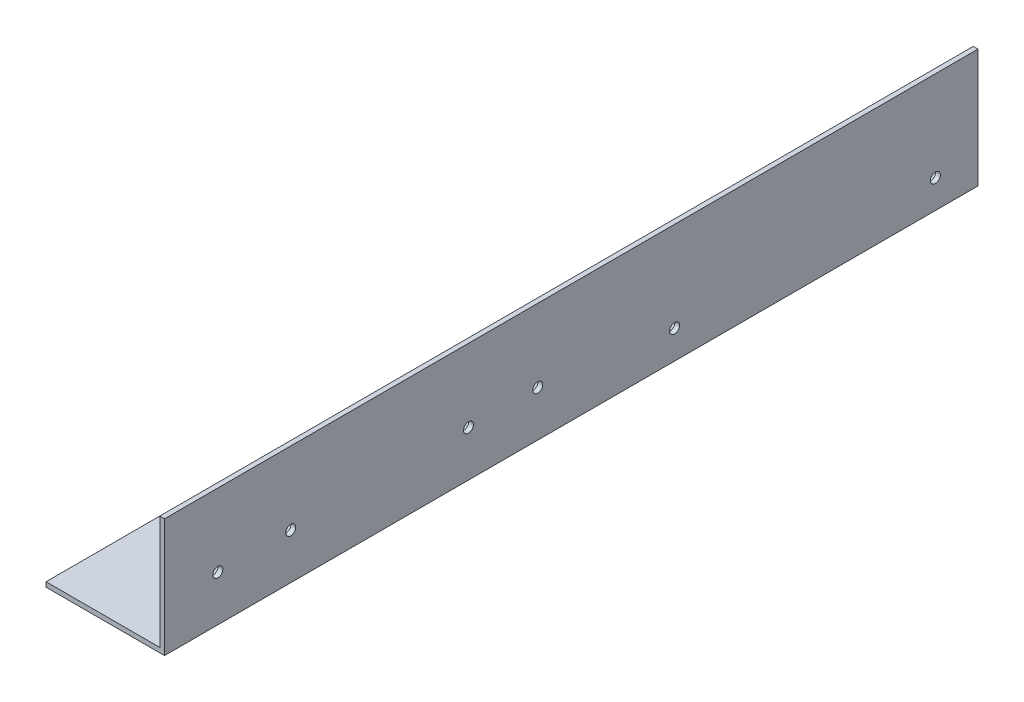
from build123d import *

# Parameters (mm, degrees)
BOSS_EXTRUDE1_DEPTH = 343.25
SKETCH2_R           = 2.1
CUT_EXTRUDE1_DEPTH  = 5
SKETCH3_R           = 2.1
CUT_EXTRUDE2_DEPTH  = 5
SKETCH4_R           = 2.75
CUT_EXTRUDE3_DEPTH  = 5


with BuildPart() as part:
    # Sketch1 → Boss-Extrude1 (new body)
    with BuildSketch(Plane.XY):
        Polygon((0, 0), (-50, 0), (-50, 2), (-2, 2), (-2, 50), (0, 50), align=None)
    extrude(amount=BOSS_EXTRUDE1_DEPTH)

    # Sketch2 → Cut-Extrude1 (cut, symmetric)
    with BuildSketch(Plane(origin=(0, 0, 0), x_dir=(0, 0, -1), z_dir=(1, 0, 0))):
        with Locations((-185.75, 19.25)):
            Circle(SKETCH2_R)
        with Locations((-215, 19.25)):
            Circle(SKETCH2_R)
        with Locations((-290, 19.25)):
            Circle(SKETCH2_R)
        with Locations((-320.75, 19.25)):
            Circle(SKETCH2_R)
    extrude(amount=CUT_EXTRUDE1_DEPTH, both=True, mode=Mode.SUBTRACT)

    # Sketch3 → Cut-Extrude2 (cut, symmetric)
    with BuildSketch(Plane(origin=(0, 0, 0), x_dir=(0, 0, -1), z_dir=(1, 0, 0))):
        with Locations((-18, 12)):
            Circle(SKETCH3_R)
        with Locations((-128, 12)):
            Circle(SKETCH3_R)
    extrude(amount=CUT_EXTRUDE2_DEPTH, both=True, mode=Mode.SUBTRACT)

    # Sketch4 → Cut-Extrude3 (cut, symmetric)
    with BuildSketch(Plane(origin=(0, 0, 0), x_dir=(1, 0, 0), z_dir=(0, 1, 0))):
        with Locations(Location((-25, -12.5, 0), (0, 0, 270))):
            Circle(SKETCH4_R)
        with Locations(Location((-25, -37.5, 0), (0, 0, 270))):
            Circle(SKETCH4_R)
    extrude(amount=CUT_EXTRUDE3_DEPTH, both=True, mode=Mode.SUBTRACT)


solid = part.part
